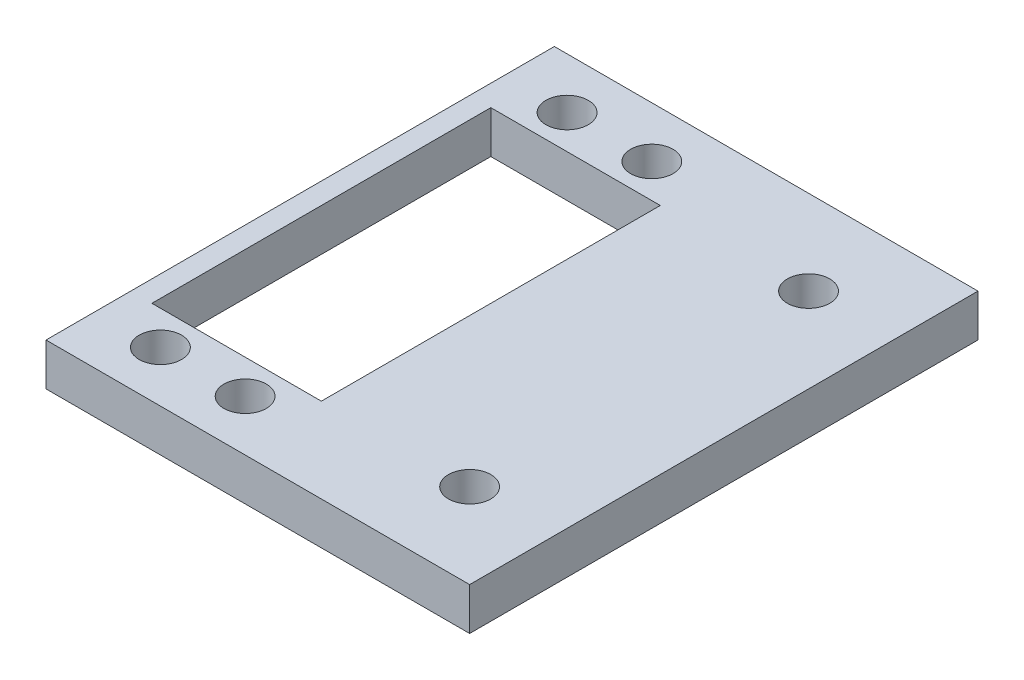
from build123d import *

# Parameters (mm, degrees)
SKETCH1_W           = 50
SKETCH1_H           = 60
SKETCH1_R           = 2.5
SKETCH1_W_2         = 20
SKETCH1_H_2         = 40
BOSS_EXTRUDE1_DEPTH = 5


with BuildPart() as part:
    # Sketch1 → Boss-Extrude1 (new body)
    with BuildSketch(Plane(origin=(0, 0, 0), x_dir=(1, 0, 0), z_dir=(0, 1, 0))):
        with Locations((-25.619469027, 11.991150442)):
            Rectangle(SKETCH1_W, SKETCH1_H)
        with Locations(Location((-10.619469027, 31.991150442, 0), (0, 0, 270))):
            Circle(SKETCH1_R, mode=Mode.SUBTRACT)
        with Locations(Location((-10.619469027, -8.008849558, 0), (0, 0, 90))):
            Circle(SKETCH1_R, mode=Mode.SUBTRACT)
        with Locations(Location((-43.119469027, 35.991150442, 0), (0, 0, 270))):
            Circle(SKETCH1_R, mode=Mode.SUBTRACT)
        with Locations(Location((-33.119469027, 35.991150442, 0), (0, 0, 270))):
            Circle(SKETCH1_R, mode=Mode.SUBTRACT)
        with Locations(Location((-43.119469027, -12.008849558, 0), (0, 0, 90))):
            Circle(SKETCH1_R, mode=Mode.SUBTRACT)
        with Locations(Location((-33.119469027, -12.008849558, 0), (0, 0, 90))):
            Circle(SKETCH1_R, mode=Mode.SUBTRACT)
        with Locations((-38.119469027, 11.991150442)):
            Rectangle(SKETCH1_W_2, SKETCH1_H_2, mode=Mode.SUBTRACT)
    extrude(amount=BOSS_EXTRUDE1_DEPTH)


solid = part.part
